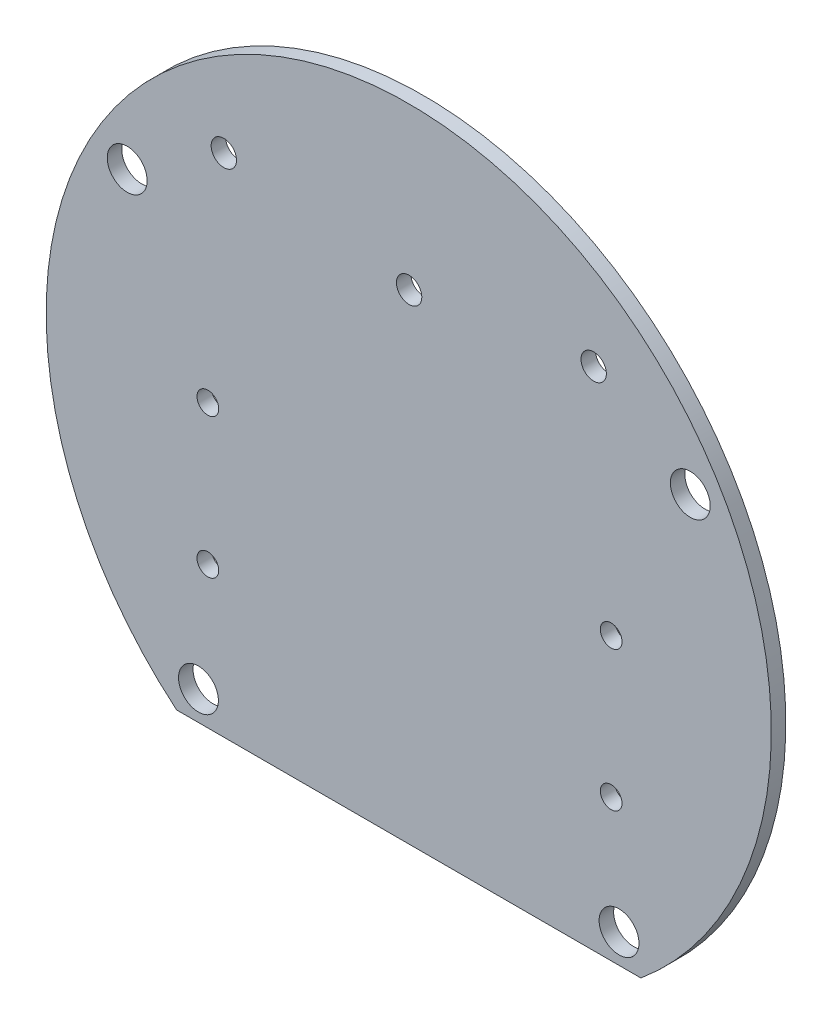
from build123d import *

# Parameters (mm, degrees)
ESBO_O1_R                  = 50
RESSALTO_EXTRUS_O1_DEPTH   = 2
ESBO_O2_R                  = 2.75
CORTE_EXTRUS_O1_DEPTH      = 2
CORTE_EXTRUS_O2_DEPTH      = 71.738956735
CORTE_EXTRUS_O2_DEPTH_BACK = 10
ESBO_O5_R                  = 1.5
ESBO_O5_R_2                = 1.75
CORTE_EXTRUS_O3_DEPTH      = 10


with BuildPart() as part:
    # Esboço1 → Ressalto-extrusão1 (new body)
    with BuildSketch(Plane.XY):
        Circle(ESBO_O1_R)
    extrude(amount=RESSALTO_EXTRUS_O1_DEPTH)

    # Esboço2 → Corte-extrusão1 (cut)
    with BuildSketch(Plane.XY.offset(2)):
        with Locations((-29, -34.409301068)):
            Circle(ESBO_O2_R)
        with Locations((29, -34.409301068)):
            Circle(ESBO_O2_R)
        with Locations((-38.824197531, 22.752619324)):
            Circle(ESBO_O2_R)
        with Locations((38.824197531, 22.752619324)):
            Circle(ESBO_O2_R)
    extrude(amount=-CORTE_EXTRUS_O1_DEPTH, mode=Mode.SUBTRACT)

    # Esboço4 → Corte-extrusão2 (cut, two sides: drawn at the far end of the back side and taken through both)
    with BuildSketch(Plane.XY.offset(2).offset(-CORTE_EXTRUS_O2_DEPTH_BACK)):
        Polygon((-40.723859979, -38.409301068), (44.57073926, -38.409301068), (1.923439641, -68.002213614), align=None)
    extrude(amount=CORTE_EXTRUS_O2_DEPTH + CORTE_EXTRUS_O2_DEPTH_BACK, mode=Mode.SUBTRACT)

    # Esboço5 → Corte-extrusão3 (cut)
    with BuildSketch(Plane(origin=(0, 0, 0), x_dir=(-1, 0, 0), z_dir=(0, 0, -1))):
        with Locations((-27.91, -18.86)):
            Circle(ESBO_O5_R)
        with Locations((27.7, -18.86)):
            Circle(ESBO_O5_R)
        with Locations((27.7, 0.44)):
            Circle(ESBO_O5_R)
        with Locations((-27.91, 0.44)):
            Circle(ESBO_O5_R)
        with Locations((25.5, 31.36)):
            Circle(ESBO_O5_R_2)
        with Locations((-0.05, 27.79)):
            Circle(ESBO_O5_R_2)
        with Locations((-25.5, 31.36)):
            Circle(ESBO_O5_R_2)
    extrude(amount=-CORTE_EXTRUS_O3_DEPTH, mode=Mode.SUBTRACT)


solid = part.part
